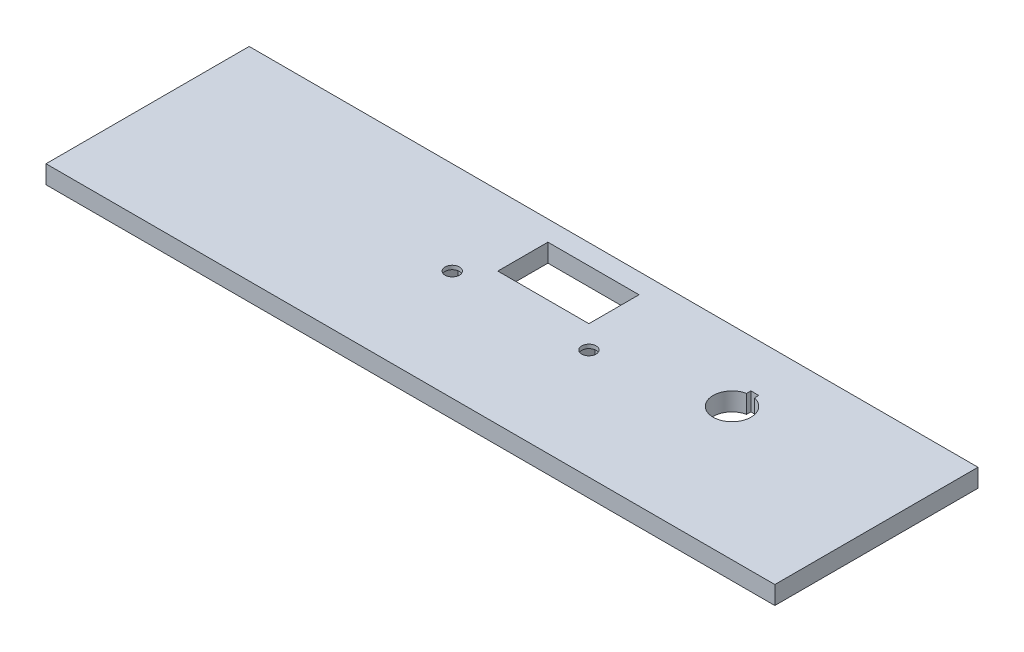
from build123d import *

# Parameters (mm, degrees)
SKETCH2_W           = 203.2
SKETCH2_H           = 56.642
SKETCH2_R           = 2
SKETCH2_W_2         = 25.4
SKETCH2_H_2         = 13.97
BOSS_EXTRUDE1_DEPTH = 5.08
CUT_EXTRUDE1_DEPTH  = 4
BOSS_EXTRUDE2_START = -56.642
SKETCH5_W           = 6.35
SKETCH5_H           = 7.62
SKETCH5_R           = 1.5
SKETCH5_H_2         = 5.08
BOSS_EXTRUDE2_DEPTH = 3.81


with BuildPart() as part:
    # Sketch2 → Boss-Extrude1 (new body)
    with BuildSketch(Plane(origin=(0, 0, 0), x_dir=(1, 0, 0), z_dir=(0, 1, 0))):
        Rectangle(SKETCH2_W, SKETCH2_H)
        with Locations(Location((-19.05, 2.392044149, 0), (0, 0, 270))):
            Circle(SKETCH2_R, mode=Mode.SUBTRACT)
        with Locations((0, 15.727044149)):
            Rectangle(SKETCH2_W_2, SKETCH2_H_2, mode=Mode.SUBTRACT)
        with Locations(Location((19.05, 2.392044149, 0), (0, 0, 270))):
            Circle(SKETCH2_R, mode=Mode.SUBTRACT)
        with BuildLine():
            Line((51.503794476, 13.896514657), (51.503794476, 15.095394657))
            Line((51.503794476, 15.095394657), (53.703434476, 15.095394657))
            Line((53.703434476, 15.095394657), (53.703434476, 13.896514657))
            ThreePointArc((53.703434476, 13.896514657), (56.700855716, 12.057279355), (57.874114476, 8.742044149))
            ThreePointArc((57.874114476, 8.742044149), (49.28837927, 4.644802909), (51.503794476, 13.896514657))
        make_face(mode=Mode.SUBTRACT)
    extrude(amount=BOSS_EXTRUDE1_DEPTH)

    # Sketch4 → Cut-Extrude1 (cut)
    with BuildSketch(Plane.XZ):
        Polygon((-16.769466437, -6.342044149), (-14.488932873, -2.392044149), (-16.769466437, 1.557955851), (-21.330533563, 1.557955851), (-23.611067127, -2.392044149), (-21.330533563, -6.342044149), align=None)
        Polygon((16.769466437, -6.342044149), (14.488932873, -2.392044149), (16.769466437, 1.557955851), (21.330533563, 1.557955851), (23.611067127, -2.392044149), (21.330533563, -6.342044149), align=None)
    extrude(amount=-CUT_EXTRUDE1_DEPTH, mode=Mode.SUBTRACT)

    # Sketch5 → Boss-Extrude2 (add)
    # profile 1 of 4: a face of its own
    with BuildSketch(Plane.XY.offset(28.321).offset(BOSS_EXTRUDE2_START)):
        with Locations((-63.5, -3.81)):
            Rectangle(SKETCH5_W, SKETCH5_H)
        with Locations(Location((-63.5, -3.81, 0), (0, 0, 180))):
            Circle(SKETCH5_R, mode=Mode.SUBTRACT)
    # profile 2 of 4: a face of its own
    with BuildSketch(Plane.XY.offset(28.321).offset(BOSS_EXTRUDE2_START)):
        with Locations((-63.5, 2.54)):
            Rectangle(SKETCH5_W, SKETCH5_H_2)
    # profile 3 of 4: a face of its own
    with BuildSketch(Plane.XY.offset(28.321).offset(BOSS_EXTRUDE2_START)):
        with Locations((63.5, 2.54)):
            Rectangle(SKETCH5_W, SKETCH5_H_2)
    # profile 4 of 4: a face of its own
    with BuildSketch(Plane.XY.offset(28.321).offset(BOSS_EXTRUDE2_START)):
        with Locations((63.5, -3.81)):
            Rectangle(SKETCH5_W, SKETCH5_H)
        with Locations(Location((63.5, -3.81, 0), (0, 0, 180))):
            Circle(SKETCH5_R, mode=Mode.SUBTRACT)
    extrude(amount=BOSS_EXTRUDE2_DEPTH)


solid = part.part
